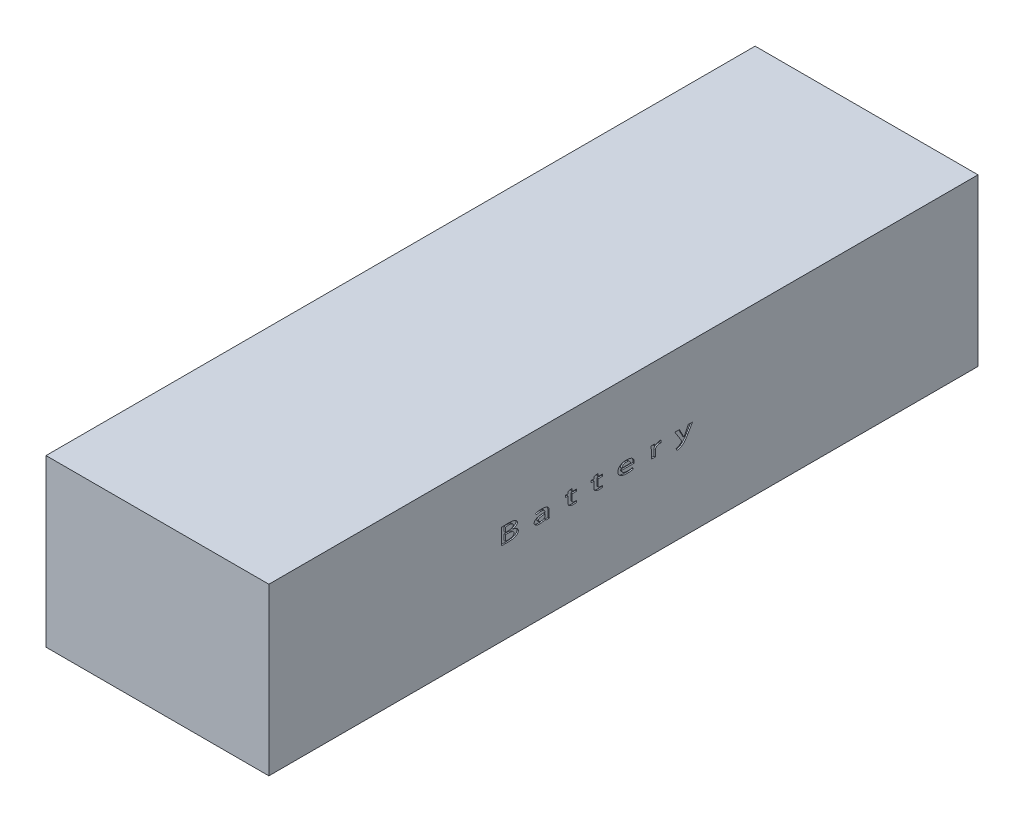
from build123d import *

# Parameters (mm, degrees)
SKETCH1_W           = 43.999912
SKETCH1_H           = 139.999974
BOSS_EXTRUDE1_DEPTH = 32.766
CUT_EXTRUDE1_DEPTH  = 0.254


with BuildPart() as part:
    # Sketch1 → Boss-Extrude1 (new body)
    with BuildSketch(Plane(origin=(0, 0, 0), x_dir=(1, 0, 0), z_dir=(0, 1, 0))):
        with Locations((-2.427323281, -29.833462089)):
            Rectangle(SKETCH1_W, SKETCH1_H)
    extrude(amount=BOSS_EXTRUDE1_DEPTH)

    # Sketch2 → Cut-Extrude1 (cut)
    # profile 1 of 7: a face of its own
    with BuildSketch(Plane(origin=(19.572632719, 0, 0), x_dir=(0, 0, -1), z_dir=(1, 0, 0))):
        with BuildLine():
            add(Edge.make_bspline(
                [(-51.644291749, 18.111815751), (-51.610507146, 18.120307394), (-51.544578306, 18.13687838), (-51.449522542, 18.165633579), (-51.360334848, 18.19672778), (-51.277262345, 18.230809107), (-51.199852593, 18.267227642), (-51.128459681, 18.306151153), (-51.062780328, 18.347347518), (-51.003702235, 18.391596204), (-50.950718277, 18.437680503), (-50.904535731, 18.485461918), (-50.865212213, 18.534652658), (-50.833330319, 18.585351353), (-50.807542728, 18.637101414), (-50.78985994, 18.690770773), (-50.777708305, 18.745758693), (-50.776006496, 18.783141249), (-50.775149692, 18.801962104)],
                knots=[0, 0, 0, 0, 1.40533938, 2.742444467, 4.005339358, 5.214808595, 6.363594937, 7.45521793, 8.493778442, 9.488835733, 10.430207034, 11.324115341, 12.1665113, 12.96612015, 13.736627496, 14.492742677, 15.241146812, 16, 16, 16, 16], degree=3))
            add(Edge.make_bspline(
                [(-50.775149692, 18.801962104), (-50.773682843, 18.823335988), (-50.770715604, 18.866572501), (-50.782452172, 18.932106535), (-50.806622471, 18.997213613), (-50.842948666, 19.0623868), (-50.893354834, 19.126484033), (-50.955081608, 19.191299937), (-51.03047204, 19.254909205), (-51.10079095, 19.308475992), (-51.165944689, 19.349378653), (-51.222050069, 19.379202484), (-51.284789928, 19.406670814), (-51.353622802, 19.43215787), (-51.428613329, 19.456353003), (-51.510160484, 19.477320745), (-51.597689402, 19.497915944), (-51.691698536, 19.516475165), (-51.791998322, 19.532308621), (-51.898608402, 19.546590729), (-52.011303771, 19.559988449), (-52.130505643, 19.570454061), (-52.255829064, 19.579428422), (-52.387330196, 19.586744752), (-52.525252611, 19.591192104), (-52.619250094, 19.593390293), (-52.667339549, 19.594514894)],
                knots=[0, 0, 0, 0, 0.685925799, 1.387536325, 2.117317602, 2.909010788, 3.772856223, 4.729195708, 5.778720239, 6.937293621, 7.564918212, 8.247182512, 8.975893934, 9.762644356, 10.603656649, 11.505160467, 12.4657627, 13.491243463, 14.581602467, 15.726198149, 16.945488129, 18.225886731, 19.56860428, 20.98046062, 22.455192665, 24, 24, 24, 24], degree=3))
            add(Edge.make_bspline(
                [(-52.667339549, 19.594514894), (-52.726802859, 19.594292528), (-52.84414423, 19.593853723), (-53.018156293, 19.590141046), (-53.187981987, 19.584249884), (-53.352408101, 19.57588769), (-53.508651089, 19.565793281), (-53.653932276, 19.554503707), (-53.787071588, 19.542181214), (-53.871550225, 19.532221193), (-53.911838983, 19.527471154)],
                knots=[0, 0, 0, 0, 1.144427208, 2.258344793, 3.349658298, 4.41477178, 5.426871411, 6.362906018, 7.219252515, 8, 8, 8, 8], degree=3))
            Line((-53.911838983, 19.527471154), (-53.911838399, 16.388208563))
            add(Edge.make_bspline(
                [(-53.911838399, 16.388208563), (-53.881119882, 16.385543687), (-53.815940003, 16.379889236), (-53.712332152, 16.373716328), (-53.597416486, 16.367433885), (-53.471065681, 16.363265526), (-53.33342362, 16.357736794), (-53.184131235, 16.355596012), (-53.023522376, 16.352021164), (-52.912570245, 16.351133509), (-52.855301464, 16.350675339)],
                knots=[0, 0, 0, 0, 0.699774169, 1.484811109, 2.355488637, 3.311718364, 4.353935581, 5.481794406, 6.700209146, 8, 8, 8, 8], degree=3))
            add(Edge.make_bspline(
                [(-52.855301464, 16.350675339), (-52.801825845, 16.350974392), (-52.696861732, 16.351561385), (-52.542776945, 16.35412016), (-52.395129349, 16.360534481), (-52.254009869, 16.367975406), (-52.119289185, 16.378142915), (-51.990952389, 16.390685588), (-51.869171753, 16.405471667), (-51.753795982, 16.422859475), (-51.644593815, 16.442593237), (-51.541160914, 16.464651827), (-51.443192811, 16.488978422), (-51.351482841, 16.516636403), (-51.265134215, 16.545681953), (-51.185283682, 16.578271132), (-51.110282615, 16.611906253), (-51.063709157, 16.637875088), (-51.040930235, 16.650576357)],
                knots=[0, 0, 0, 0, 1.382182602, 2.71300402, 3.982736333, 5.201693476, 6.365383053, 7.474336612, 8.534287225, 9.535711254, 10.489635997, 11.402018248, 12.268835929, 13.097727171, 13.877308873, 14.622384863, 15.326213083, 16, 16, 16, 16], degree=3))
            add(Edge.make_bspline(
                [(-51.040930235, 16.650576357), (-51.014857146, 16.664800643), (-50.961392717, 16.69396839), (-50.885777376, 16.749219888), (-50.811331991, 16.813425322), (-50.750314846, 16.872543688), (-50.705159029, 16.925839553), (-50.674928259, 16.969538077), (-50.648435188, 17.016030348), (-50.62713348, 17.06598718), (-50.609456587, 17.11858238), (-50.596528277, 17.174320962), (-50.587361166, 17.233154297), (-50.584868265, 17.273492249), (-50.583596148, 17.294076546)],
                knots=[0, 0, 0, 0, 1.286238673, 2.637509324, 4.048412503, 5.546762111, 6.3141741, 7.072318851, 7.846862039, 8.629332221, 9.422484273, 10.249026761, 11.106485285, 12, 12, 12, 12], degree=3))
            add(Edge.make_bspline(
                [(-50.583596148, 17.294076546), (-50.585690955, 17.321509085), (-50.589796999, 17.375279766), (-50.607840424, 17.453426275), (-50.63398903, 17.527638926), (-50.670209483, 17.597435555), (-50.715881065, 17.662651404), (-50.77004308, 17.724171262), (-50.834017036, 17.781040904), (-50.906495158, 17.833152811), (-50.984975624, 17.881130703), (-51.068052094, 17.924645706), (-51.154220579, 17.965217556), (-51.244967862, 18.000321623), (-51.33933143, 18.031287173), (-51.437391729, 18.05834035), (-51.539260127, 18.081255017), (-51.608941728, 18.092759706), (-51.6443239, 18.098601433)],
                knots=[0, 0, 0, 0, 0.913562479, 1.790679196, 2.657271798, 3.523635851, 4.395897479, 5.298288241, 6.242549711, 7.235072255, 8.262453639, 9.298111546, 10.351715563, 11.427167575, 12.530612634, 13.652370922, 14.807946209, 16, 16, 16, 16], degree=3))
            Line((-51.6443239, 18.098601433), (-51.644291749, 18.111815751))
        make_face()
        with BuildLine():
            Line((-53.112101181, 18.254238103), (-53.112101181, 19.199360883))
            add(Edge.make_bspline(
                [(-53.112101181, 19.199360883), (-53.099137156, 19.200832518), (-53.070843554, 19.204044316), (-53.024729712, 19.208105163), (-52.971644959, 19.212183776), (-52.911424493, 19.216739746), (-52.843341134, 19.219346829), (-52.766925797, 19.221962358), (-52.681707746, 19.222886807), (-52.622044926, 19.223210134), (-52.590718131, 19.223379902)],
                knots=[0, 0, 0, 0, 0.599590922, 1.30858956, 2.127236431, 3.046476336, 4.083695706, 5.258023581, 6.560287062, 8, 8, 8, 8], degree=3))
            add(Edge.make_bspline(
                [(-52.590718131, 19.223379902), (-52.527234433, 19.223144248), (-52.403610869, 19.222685354), (-52.223508796, 19.206031958), (-52.054653965, 19.175124117), (-51.922061697, 19.140316747), (-51.824829928, 19.104029341), (-51.761708357, 19.070628595), (-51.707500146, 19.031461172), (-51.662597162, 18.98650919), (-51.62586196, 18.936545608), (-51.599541142, 18.88011072), (-51.580855283, 18.818624675), (-51.5769091, 18.77516167), (-51.57488574, 18.752876508)],
                knots=[0, 0, 0, 0, 1.851259311, 3.605008578, 5.267298526, 6.854427038, 7.597018629, 8.289662199, 8.931136827, 9.54026623, 10.136381007, 10.729961357, 11.34880213, 12, 12, 12, 12], degree=3))
            add(Edge.make_bspline(
                [(-51.57488574, 18.752876508), (-51.576001183, 18.734808966), (-51.578217727, 18.69890616), (-51.593637658, 18.646977843), (-51.61556664, 18.597109805), (-51.647422924, 18.550685384), (-51.687815725, 18.507361692), (-51.735865448, 18.465729092), (-51.793116581, 18.427852045), (-51.858087318, 18.392627597), (-51.930143933, 18.360247655), (-52.009544449, 18.333309032), (-52.094948703, 18.308991696), (-52.186999995, 18.289647907), (-52.285688948, 18.2740191), (-52.390789006, 18.262943773), (-52.502423519, 18.255618082), (-52.578933695, 18.254311542), (-52.618253953, 18.253640083)],
                knots=[0, 0, 0, 0, 0.686723571, 1.364618527, 2.047638696, 2.75307796, 3.494649314, 4.29675263, 5.166438123, 6.100796313, 7.106810053, 8.168117075, 9.288194686, 10.483966669, 11.744669978, 13.088695348, 14.503816638, 16, 16, 16, 16], degree=3))
            Line((-52.618253953, 18.253640083), (-53.112101181, 18.254238103))
        make_face(mode=Mode.SUBTRACT)
        with BuildLine():
            Line((-53.112101181, 17.883103111), (-52.646058679, 17.883103111))
            add(Edge.make_bspline(
                [(-52.646058679, 17.883103111), (-52.606457516, 17.88273762), (-52.528504459, 17.882018168), (-52.413346102, 17.876952802), (-52.302189272, 17.866394243), (-52.194625308, 17.853110162), (-52.091010208, 17.834329086), (-51.990906676, 17.811690054), (-51.89458158, 17.784794101), (-51.802976462, 17.754190879), (-51.718088467, 17.719362012), (-51.643312826, 17.677321327), (-51.578856559, 17.629742695), (-51.524860673, 17.576442863), (-51.482437721, 17.516676196), (-51.449925715, 17.45189614), (-51.429447208, 17.380788691), (-51.424281007, 17.331313155), (-51.421642905, 17.306048643)],
                knots=[0, 0, 0, 0, 1.281443891, 2.522462947, 3.728387058, 4.893611254, 6.028385756, 7.134191537, 8.21353693, 9.262999663, 10.258314291, 11.177687313, 12.03124732, 12.843901211, 13.621480188, 14.392436769, 15.179103377, 16, 16, 16, 16], degree=3))
            add(Edge.make_bspline(
                [(-51.421642905, 17.306048643), (-51.423847263, 17.280780562), (-51.428158824, 17.231358071), (-51.44790737, 17.160467676), (-51.477253023, 17.095014324), (-51.517769055, 17.035317817), (-51.56843202, 16.981180346), (-51.629887752, 16.933130011), (-51.701153801, 16.890531178), (-51.782048554, 16.854148056), (-51.870057351, 16.822307428), (-51.963709482, 16.794904565), (-52.062212553, 16.771551614), (-52.165481425, 16.752435841), (-52.273799341, 16.738207659), (-52.386637644, 16.728244067), (-52.504445312, 16.72189616), (-52.584524189, 16.721839354), (-52.625437211, 16.721810332)],
                knots=[0, 0, 0, 0, 0.825140384, 1.613913382, 2.385120956, 3.153444474, 3.954004159, 4.791858536, 5.687383797, 6.653418539, 7.677895759, 8.735518243, 9.831720095, 10.975790606, 12.156656025, 13.390649828, 14.666859426, 16, 16, 16, 16], degree=3))
            add(Edge.make_bspline(
                [(-52.625437211, 16.721810332), (-52.674526416, 16.721780475), (-52.766929023, 16.721724273), (-52.897025926, 16.72507958), (-53.010284964, 16.728876126), (-53.079995375, 16.735104135), (-53.112102935, 16.737972662)],
                knots=[0, 0, 0, 0, 1.209222335, 2.27616837, 3.206029248, 4, 4, 4, 4], degree=3))
            Line((-53.112102935, 16.737972662), (-53.112101181, 17.883103111))
        make_face(mode=Mode.SUBTRACT)
    # profile 2 of 7: a face of its own
    with BuildSketch(Plane(origin=(19.572632719, 0, 0), x_dir=(0, 0, -1), z_dir=(1, 0, 0))):
        with BuildLine():
            add(Edge.make_bspline(
                [(-44.511105838, 17.774539344), (-44.51069283, 17.806379688), (-44.509877392, 17.869244931), (-44.522781498, 17.961811312), (-44.543730167, 18.051065126), (-44.576695123, 18.136142316), (-44.61954468, 18.217422357), (-44.672415941, 18.295256841), (-44.736751541, 18.36807325), (-44.796970596, 18.426026611), (-44.851088709, 18.469399081), (-44.896512459, 18.500230223), (-44.946150321, 18.528579529), (-44.999361444, 18.55566537), (-45.056813262, 18.580248558), (-45.118130092, 18.602892517), (-45.183577705, 18.623044064), (-45.252827268, 18.641750512), (-45.326093709, 18.658436668), (-45.403628064, 18.672661345), (-45.485078235, 18.685173322), (-45.570482314, 18.696059858), (-45.659951801, 18.704173778), (-45.7533349, 18.710953708), (-45.85075779, 18.714947097), (-45.917029751, 18.716281284), (-45.950753953, 18.716960219)],
                knots=[0, 0, 0, 0, 1.175097073, 2.320099431, 3.443145923, 4.556395639, 5.681038434, 6.832409001, 8.024035987, 9.265269995, 9.915865327, 10.584591153, 11.291530857, 12.026853553, 12.78975311, 13.599224161, 14.441089397, 15.319269759, 16.249370038, 17.216828846, 18.231462663, 19.294144735, 20.397584596, 21.550653699, 22.75358674, 24, 24, 24, 24], degree=3))
            add(Edge.make_bspline(
                [(-45.950753953, 18.716960219), (-46.013620718, 18.716000897), (-46.136840263, 18.714120615), (-46.317372014, 18.703967112), (-46.489753661, 18.687434545), (-46.652395951, 18.664021905), (-46.803910264, 18.636668711), (-46.942422108, 18.606457733), (-47.067273251, 18.572928681), (-47.144706346, 18.545985836), (-47.181485476, 18.533188537)],
                knots=[0, 0, 0, 0, 1.207104173, 2.365937362, 3.470692301, 4.531002334, 5.519938855, 6.426242244, 7.25249737, 8, 8, 8, 8], degree=3))
            Line((-47.181485476, 18.533188537), (-47.014544879, 18.210371009))
            add(Edge.make_bspline(
                [(-47.014544879, 18.210371009), (-46.982737379, 18.22280041), (-46.91723677, 18.248396052), (-46.813427513, 18.280011777), (-46.702932461, 18.309063212), (-46.585892468, 18.332386982), (-46.464943311, 18.352161971), (-46.341130186, 18.366669324), (-46.2154555, 18.375081197), (-46.130946311, 18.37632631), (-46.088433063, 18.376952677)],
                knots=[0, 0, 0, 0, 0.865696267, 1.782712677, 2.749790371, 3.761974007, 4.807613163, 5.857004061, 6.921943056, 8, 8, 8, 8], degree=3))
            add(Edge.make_bspline(
                [(-46.088433063, 18.376952677), (-46.044899644, 18.375291155), (-45.962052087, 18.372129147), (-45.844757658, 18.359389716), (-45.740756642, 18.342313195), (-45.649851706, 18.321020463), (-45.572381186, 18.293011838), (-45.508223431, 18.259810502), (-45.456613143, 18.221443707), (-45.419645945, 18.176364178), (-45.393177888, 18.12952454), (-45.369271521, 18.084911334), (-45.350677644, 18.040771083), (-45.336153476, 17.998015042), (-45.326471645, 17.956087322), (-45.32084204, 17.915220717), (-45.320123339, 17.875206788), (-45.323137517, 17.849163638), (-45.324613304, 17.836412519)],
                knots=[0, 0, 0, 0, 1.937439985, 3.687102254, 5.244083355, 6.624016093, 7.8343197, 8.898409296, 9.828702019, 10.673093576, 11.469221061, 12.219548966, 12.923503995, 13.597148598, 14.225845967, 14.834680682, 15.429442065, 16, 16, 16, 16], degree=3))
            add(Edge.make_bspline(
                [(-45.324613304, 17.836412519), (-45.404633802, 17.835840348), (-45.560337973, 17.834727015), (-45.787563352, 17.826044777), (-46.001568956, 17.809849191), (-46.202436547, 17.787818426), (-46.390162395, 17.760346576), (-46.564480222, 17.724848492), (-46.72591659, 17.683973091), (-46.851363216, 17.643784146), (-46.944386642, 17.607895322), (-47.008750936, 17.580256572), (-47.068531594, 17.549922423), (-47.123971316, 17.518224004), (-47.175950867, 17.485713719), (-47.222400555, 17.449969862), (-47.265357744, 17.413787044), (-47.303130961, 17.374905855), (-47.337536203, 17.33514729), (-47.366922349, 17.292863035), (-47.392240362, 17.249039934), (-47.41322871, 17.203338762), (-47.430130573, 17.156122757), (-47.442073073, 17.106952069), (-47.449974644, 17.056270435), (-47.451756346, 17.021738985), (-47.452653463, 17.00435181)],
                knots=[0, 0, 0, 0, 2.319145786, 4.512602176, 6.588780181, 8.537850986, 10.368209225, 12.085289648, 13.691265688, 15.192708731, 15.89936613, 16.580504135, 17.2218911, 17.840910598, 18.431253869, 18.996831738, 19.538148586, 20.057488983, 20.566191964, 21.060321819, 21.547362121, 22.031233527, 22.515933599, 22.998420732, 23.495687737, 24, 24, 24, 24], degree=3))
            add(Edge.make_bspline(
                [(-47.452653463, 17.00435181), (-47.451540152, 16.981917704), (-47.449340308, 16.937589067), (-47.434105354, 16.872849241), (-47.411505538, 16.810352966), (-47.378688691, 16.750851002), (-47.336749621, 16.69419384), (-47.286180903, 16.640113889), (-47.226204316, 16.589253538), (-47.158126177, 16.54084269), (-47.081584574, 16.496500043), (-46.99657576, 16.458370281), (-46.904218558, 16.42566949), (-46.804283118, 16.397872456), (-46.696534057, 16.376909076), (-46.581075635, 16.36057602), (-46.45793478, 16.350624916), (-46.373186577, 16.348285126), (-46.329670808, 16.34708371)],
                knots=[0, 0, 0, 0, 0.750511685, 1.48297235, 2.21628528, 2.969526539, 3.748393557, 4.5707007, 5.442262283, 6.37636123, 7.363928854, 8.398211377, 9.490482838, 10.641058478, 11.867172727, 13.162248732, 14.542896199, 16, 16, 16, 16], degree=3))
            add(Edge.make_bspline(
                [(-46.329670808, 16.34708371), (-46.271754913, 16.348201516), (-46.15926328, 16.350372661), (-45.99638701, 16.367986662), (-45.844047176, 16.392709015), (-45.703599296, 16.429258969), (-45.57569307, 16.474368118), (-45.460096179, 16.524094197), (-45.357710352, 16.580541018), (-45.297827441, 16.625364314), (-45.268943056, 16.646984729)],
                knots=[0, 0, 0, 0, 1.238809554, 2.406173785, 3.501775666, 4.538290854, 5.506387597, 6.401092189, 7.228770462, 8, 8, 8, 8], degree=3))
            Line((-45.268943056, 16.646984729), (-45.247549948, 16.647102228))
            Line((-45.247549948, 16.647102228), (-45.191440099, 16.385393835))
            Line((-45.191440099, 16.385393835), (-44.45535141, 16.385393835))
            add(Edge.make_bspline(
                [(-44.45535141, 16.385393835), (-44.461042085, 16.404679362), (-44.472738314, 16.444317527), (-44.485344157, 16.506428525), (-44.495902487, 16.571890986), (-44.503853791, 16.664217328), (-44.510648086, 16.783562632), (-44.510954185, 16.880029328), (-44.511109345, 16.928927602)],
                knots=[0, 0, 0, 0, 0.659613556, 1.355725, 2.078136816, 2.834647581, 4.395505649, 6, 6, 6, 6], degree=3))
            Line((-44.511109345, 16.928927602), (-44.511105838, 17.774539344))
        make_face()
        with BuildLine():
            add(Edge.make_bspline(
                [(-45.303659797, 17.157166152), (-45.304903965, 17.140261532), (-45.30736216, 17.106861807), (-45.320734911, 17.058358323), (-45.339650939, 17.01206902), (-45.365973971, 16.968528442), (-45.398596999, 16.927317271), (-45.438764937, 16.889169409), (-45.484758377, 16.852457421), (-45.537642642, 16.819358517), (-45.595071126, 16.789122611), (-45.65661351, 16.762801646), (-45.721309208, 16.739853439), (-45.789664763, 16.721663767), (-45.861134476, 16.706436835), (-45.936135273, 16.695818624), (-46.014693458, 16.689268834), (-46.068267639, 16.687827187), (-46.095616321, 16.687091252)],
                knots=[0, 0, 0, 0, 0.804507734, 1.589526174, 2.380944637, 3.176903039, 4.001052039, 4.873621094, 5.80598128, 6.795979721, 7.836119167, 8.890451785, 9.97709827, 11.098383502, 12.252488745, 13.451123295, 14.698843085, 16, 16, 16, 16], degree=3))
            add(Edge.make_bspline(
                [(-46.095616321, 16.687091252), (-46.132405419, 16.687734008), (-46.203609887, 16.688978048), (-46.306080151, 16.706394848), (-46.400284695, 16.733474348), (-46.471955076, 16.765984266), (-46.522972806, 16.797865075), (-46.556183045, 16.824985298), (-46.584850258, 16.855170408), (-46.608232582, 16.888983581), (-46.626981078, 16.925832266), (-46.640716483, 16.965721024), (-46.649940899, 17.008748861), (-46.651904498, 17.038624675), (-46.652917414, 17.054036011)],
                knots=[0, 0, 0, 0, 1.774995276, 3.435463203, 5.002930675, 6.499276085, 7.218489681, 7.903370446, 8.564723899, 9.222415656, 9.881870381, 10.555469583, 11.254843944, 12, 12, 12, 12], degree=3))
            add(Edge.make_bspline(
                [(-46.652917414, 17.054036011), (-46.649647118, 17.077990528), (-46.643225137, 17.125030751), (-46.617859506, 17.191345239), (-46.580598402, 17.25141634), (-46.53052775, 17.304251965), (-46.46884329, 17.351252384), (-46.394339188, 17.389902342), (-46.308595773, 17.423854109), (-46.176522525, 17.458451259), (-45.998864117, 17.490959028), (-45.776053135, 17.519451477), (-45.543116788, 17.534411116), (-45.384492664, 17.534216336), (-45.303662135, 17.534117081)],
                knots=[0, 0, 0, 0, 0.559527784, 1.098761892, 1.633263596, 2.190218119, 2.778293053, 3.424639982, 4.131434944, 4.914419041, 6.588084024, 8.319680607, 10.124609599, 12, 12, 12, 12], degree=3))
            Line((-45.303662135, 17.534117081), (-45.303659797, 17.157166152))
        make_face(mode=Mode.SUBTRACT)
    # profile 3 of 7: a face of its own
    with BuildSketch(Plane(origin=(19.572632719, 0, 0), x_dir=(0, 0, -1), z_dir=(1, 0, 0))):
        with BuildLine():
            Line((-40.763603104, 18.675655901), (-41.307208774, 18.675655901))
            Line((-41.307208774, 18.675655901), (-41.307208774, 18.304520324))
            Line((-41.307208774, 18.304520324), (-40.763603104, 18.304520324))
            Line((-40.763603104, 18.304520324), (-40.763603104, 17.117494552))
            add(Edge.make_bspline(
                [(-40.763603104, 17.117494552), (-40.762952129, 17.081724719), (-40.761707083, 17.013311938), (-40.748116235, 16.915486632), (-40.727378824, 16.826993642), (-40.696414293, 16.747868674), (-40.656558305, 16.676899225), (-40.60622703, 16.614760907), (-40.547736153, 16.558609149), (-40.501978971, 16.529515128), (-40.478667792, 16.514693062)],
                knots=[0, 0, 0, 0, 1.223601265, 2.340239155, 3.373938585, 4.327739138, 5.239299584, 6.148117949, 7.056551249, 8, 8, 8, 8], degree=3))
            add(Edge.make_bspline(
                [(-40.478667792, 16.514693062), (-40.456395798, 16.501576186), (-40.410366465, 16.474467654), (-40.333024718, 16.443083865), (-40.248509427, 16.413999535), (-40.1552487, 16.391249759), (-40.055188927, 16.372436908), (-39.948498426, 16.360818642), (-39.836326166, 16.351546314), (-39.759565602, 16.350970415), (-39.720235476, 16.350675339)],
                knots=[0, 0, 0, 0, 0.789032034, 1.63068555, 2.544851542, 3.519626375, 4.561518372, 5.654629768, 6.798293014, 8, 8, 8, 8], degree=3))
            add(Edge.make_bspline(
                [(-39.720235476, 16.350675339), (-39.686911846, 16.350989504), (-39.622252093, 16.351599094), (-39.528249703, 16.353880038), (-39.440412483, 16.357855295), (-39.35884812, 16.364262517), (-39.283520423, 16.370320674), (-39.214435885, 16.37873635), (-39.151538966, 16.388779199), (-39.111826928, 16.397026806), (-39.092897618, 16.400958145)],
                knots=[0, 0, 0, 0, 1.268637777, 2.461610698, 3.579501031, 4.615358006, 5.576105585, 6.456105163, 7.264080517, 8, 8, 8, 8], degree=3))
            Line((-39.092897618, 16.400958145), (-39.120580168, 16.750966011))
            add(Edge.make_bspline(
                [(-39.120580168, 16.750966011), (-39.145446552, 16.746858675), (-39.196686893, 16.738394988), (-39.262781798, 16.730410687), (-39.320116481, 16.725622444), (-39.368432906, 16.723324275), (-39.421128061, 16.722288276), (-39.457647159, 16.721973648), (-39.476603312, 16.721810332)],
                knots=[0, 0, 0, 0, 1.268017957, 2.612912017, 3.348274057, 4.162472496, 5.046185306, 6, 6, 6, 6], degree=3))
            add(Edge.make_bspline(
                [(-39.476603312, 16.721810332), (-39.497165387, 16.72192843), (-39.536756022, 16.722155818), (-39.594167624, 16.727030727), (-39.64717455, 16.735281292), (-39.696010538, 16.746658428), (-39.740665296, 16.760807141), (-39.780814798, 16.778715381), (-39.816789979, 16.799973638), (-39.84881908, 16.824461317), (-39.87638376, 16.853022645), (-39.900594919, 16.884161484), (-39.920679823, 16.919015399), (-39.936567928, 16.9573311), (-39.94917605, 16.998846379), (-39.958049946, 17.043546566), (-39.963672734, 17.091603034), (-39.963801252, 17.124854318), (-39.963867641, 17.14203092)],
                knots=[0, 0, 0, 0, 1.330018719, 2.560844892, 3.723996818, 4.798120937, 5.802477984, 6.750225736, 7.635880845, 8.500971941, 9.350018932, 10.197002144, 11.047324202, 11.944107126, 12.875266125, 13.850063143, 14.889408025, 16, 16, 16, 16], degree=3))
            Line((-39.963867641, 17.14203092), (-39.963865887, 18.304520324))
            Line((-39.963865887, 18.304520324), (-39.050887134, 18.304520324))
            Line((-39.050887134, 18.304520324), (-39.050887134, 18.675655901))
            Line((-39.050887134, 18.675655901), (-39.963865887, 18.675655901))
            Line((-39.963865887, 18.675655901), (-39.963865887, 19.238372498))
            Line((-39.963865887, 19.238372498), (-40.763603104, 19.089418104))
            Line((-40.763603104, 19.089418104), (-40.763603104, 18.675655901))
        make_face()
    # profile 4 of 7: a face of its own
    with BuildSketch(Plane(origin=(19.572632719, 0, 0), x_dir=(0, 0, -1), z_dir=(1, 0, 0))):
        with BuildLine():
            Line((-35.645292396, 18.675655901), (-36.188898065, 18.675655901))
            Line((-36.188898065, 18.675655901), (-36.188898065, 18.304520324))
            Line((-36.188898065, 18.304520324), (-35.645292396, 18.304520324))
            Line((-35.645292396, 18.304520324), (-35.645292396, 17.117494552))
            add(Edge.make_bspline(
                [(-35.645292396, 17.117494552), (-35.64464142, 17.081724719), (-35.643396374, 17.013311938), (-35.629805526, 16.915486632), (-35.609068115, 16.826993642), (-35.578103585, 16.747868674), (-35.538247596, 16.676899225), (-35.487916321, 16.614760907), (-35.429425444, 16.558609149), (-35.383668263, 16.529515128), (-35.360357083, 16.514693062)],
                knots=[0, 0, 0, 0, 1.223601265, 2.340239155, 3.373938585, 4.327739138, 5.239299584, 6.148117949, 7.056551249, 8, 8, 8, 8], degree=3))
            add(Edge.make_bspline(
                [(-35.360357083, 16.514693062), (-35.338085089, 16.501576186), (-35.292055756, 16.474467654), (-35.214714009, 16.443083865), (-35.130198718, 16.413999535), (-35.036937991, 16.391249759), (-34.936878218, 16.372436908), (-34.830187717, 16.360818642), (-34.718015457, 16.351546314), (-34.641254893, 16.350970415), (-34.601924767, 16.350675339)],
                knots=[0, 0, 0, 0, 0.789032034, 1.63068555, 2.544851542, 3.519626375, 4.561518372, 5.654629768, 6.798293014, 8, 8, 8, 8], degree=3))
            add(Edge.make_bspline(
                [(-34.601924767, 16.350675339), (-34.568601137, 16.350989504), (-34.503941384, 16.351599094), (-34.409938994, 16.353880038), (-34.322101774, 16.357855295), (-34.240537411, 16.364262517), (-34.165209714, 16.370320674), (-34.096125176, 16.37873635), (-34.033228258, 16.388779199), (-33.993516219, 16.397026806), (-33.974586909, 16.400958145)],
                knots=[0, 0, 0, 0, 1.268637777, 2.461610698, 3.579501031, 4.615358006, 5.576105585, 6.456105163, 7.264080517, 8, 8, 8, 8], degree=3))
            Line((-33.974586909, 16.400958145), (-34.00226946, 16.750966011))
            add(Edge.make_bspline(
                [(-34.00226946, 16.750966011), (-34.027135843, 16.746858675), (-34.078376185, 16.738394988), (-34.144471089, 16.730410687), (-34.201805772, 16.725622444), (-34.250122197, 16.723324275), (-34.302817352, 16.722288276), (-34.33933645, 16.721973648), (-34.358292603, 16.721810332)],
                knots=[0, 0, 0, 0, 1.268017957, 2.612912017, 3.348274057, 4.162472496, 5.046185306, 6, 6, 6, 6], degree=3))
            add(Edge.make_bspline(
                [(-34.358292603, 16.721810332), (-34.378854678, 16.72192843), (-34.418445313, 16.722155818), (-34.475856915, 16.727030727), (-34.528863841, 16.735281292), (-34.577699829, 16.746658428), (-34.622354587, 16.760807141), (-34.662504089, 16.778715381), (-34.69847927, 16.799973638), (-34.730508371, 16.824461317), (-34.758073051, 16.853022645), (-34.78228421, 16.884161484), (-34.802369114, 16.919015399), (-34.818257219, 16.9573311), (-34.830865341, 16.998846379), (-34.839739237, 17.043546566), (-34.845362025, 17.091603034), (-34.845490543, 17.124854318), (-34.845556932, 17.14203092)],
                knots=[0, 0, 0, 0, 1.330018719, 2.560844892, 3.723996818, 4.798120937, 5.802477984, 6.750225736, 7.635880845, 8.500971941, 9.350018932, 10.197002144, 11.047324202, 11.944107126, 12.875266125, 13.850063143, 14.889408025, 16, 16, 16, 16], degree=3))
            Line((-34.845556932, 17.14203092), (-34.845555178, 18.304520324))
            Line((-34.845555178, 18.304520324), (-33.932576425, 18.304520324))
            Line((-33.932576425, 18.304520324), (-33.932576425, 18.675655901))
            Line((-33.932576425, 18.675655901), (-34.845555178, 18.675655901))
            Line((-34.845555178, 18.675655901), (-34.845555178, 19.238372498))
            Line((-34.845555178, 19.238372498), (-35.645292396, 19.089418104))
            Line((-35.645292396, 19.089418104), (-35.645292396, 18.675655901))
        make_face()
    # profile 5 of 7: a face of its own
    with BuildSketch(Plane(origin=(19.572632719, 0, 0), x_dir=(0, 0, -1), z_dir=(1, 0, 0))):
        with BuildLine():
            add(Edge.make_bspline(
                [(-28.02261434, 16.827929405), (-28.05402648, 16.820272606), (-28.118860244, 16.80446919), (-28.219857726, 16.784399882), (-28.327259065, 16.766475231), (-28.44179592, 16.750670957), (-28.56538915, 16.738266615), (-28.69930773, 16.728505459), (-28.844467485, 16.72354704), (-28.94486683, 16.722403523), (-28.996948335, 16.721810332)],
                knots=[0, 0, 0, 0, 0.789618374, 1.62974986, 2.514281086, 3.448883772, 4.453188384, 5.547643297, 6.727855972, 8, 8, 8, 8], degree=3))
            add(Edge.make_bspline(
                [(-28.996948335, 16.721810332), (-29.03626544, 16.722063516), (-29.113362468, 16.722559987), (-29.226849051, 16.729164681), (-29.335966819, 16.74099112), (-29.440635541, 16.758420009), (-29.541053717, 16.780405265), (-29.637051135, 16.807934783), (-29.728822718, 16.840956163), (-29.815894127, 16.878621982), (-29.896345923, 16.922339109), (-29.967599048, 16.973529467), (-30.029445979, 17.031147229), (-30.080732999, 17.096230168), (-30.123220854, 17.167227313), (-30.155005701, 17.24535335), (-30.176677751, 17.330017189), (-30.183482084, 17.388940024), (-30.18697473, 17.419184955)],
                knots=[0, 0, 0, 0, 1.23368156, 2.419129846, 3.565604378, 4.676331213, 5.747378914, 6.789820605, 7.807867862, 8.806041093, 9.764539013, 10.675146914, 11.55222043, 12.407888197, 13.266985692, 14.140251183, 15.045396013, 16, 16, 16, 16], degree=3))
            Line((-30.18697473, 17.419184955), (-27.720903478, 17.419782975))
            add(Edge.make_bspline(
                [(-27.720903478, 17.419782975), (-27.717876442, 17.434518811), (-27.71156641, 17.465236521), (-27.705265885, 17.513625996), (-27.700824202, 17.565760586), (-27.700524765, 17.601749054), (-27.70037028, 17.620316176)],
                knots=[0, 0, 0, 0, 0.89349896, 1.862550644, 2.897250025, 4, 4, 4, 4], degree=3))
            add(Edge.make_bspline(
                [(-27.70037028, 17.620316176), (-27.700677668, 17.656295154), (-27.701287017, 17.727618017), (-27.717785763, 17.832536067), (-27.743732316, 17.934176694), (-27.782620646, 18.031350304), (-27.832122635, 18.125234125), (-27.893514895, 18.214885582), (-27.966060054, 18.301117292), (-28.049782067, 18.383302136), (-28.146399237, 18.459366324), (-28.257781893, 18.525373177), (-28.383324086, 18.581336354), (-28.522714076, 18.628684879), (-28.67671026, 18.66528905), (-28.844616651, 18.692138449), (-29.026469771, 18.711241395), (-29.152534805, 18.715008795), (-29.217833516, 18.716960219)],
                knots=[0, 0, 0, 0, 0.819715263, 1.624961088, 2.415394053, 3.208182229, 4.006296127, 4.831903807, 5.68156256, 6.573100061, 7.503611961, 8.479321354, 9.518208176, 10.633683883, 11.832538509, 13.124026794, 14.510313805, 16, 16, 16, 16], degree=3))
            add(Edge.make_bspline(
                [(-29.217833516, 18.716960219), (-29.28532035, 18.714958195), (-29.416547042, 18.711065304), (-29.607260749, 18.692288995), (-29.785892162, 18.6639766), (-29.952545921, 18.625383935), (-30.106946531, 18.575720662), (-30.249475336, 18.515856142), (-30.380338558, 18.446092648), (-30.497601549, 18.364796574), (-30.602361641, 18.276473542), (-30.693992407, 18.182162482), (-30.772271507, 18.08244841), (-30.835192446, 17.976092332), (-30.885901239, 17.864755719), (-30.920609326, 17.747018911), (-30.943945292, 17.624221142), (-30.946900934, 17.540212391), (-30.948400069, 17.497602187)],
                knots=[0, 0, 0, 0, 1.371641655, 2.667127607, 3.890982695, 5.044624266, 6.139660945, 7.182648261, 8.18224526, 9.147222782, 10.076512876, 10.962550312, 11.814959528, 12.645922279, 13.468063847, 14.294115457, 15.134755759, 16, 16, 16, 16], degree=3))
            add(Edge.make_bspline(
                [(-30.948400069, 17.497602187), (-30.946673316, 17.455195495), (-30.94327604, 17.371763036), (-30.919944289, 17.25024634), (-30.882869204, 17.135149562), (-30.830114379, 17.027172014), (-30.762978358, 16.925896594), (-30.681563776, 16.83112099), (-30.584463438, 16.74435306), (-30.474353763, 16.663392886), (-30.349968223, 16.590964196), (-30.212136179, 16.528499743), (-30.061683373, 16.474349173), (-29.89800592, 16.430615468), (-29.721403468, 16.39596011), (-29.531828194, 16.371465989), (-29.329258441, 16.354895217), (-29.189733319, 16.352109969), (-29.11786651, 16.350675339)],
                knots=[0, 0, 0, 0, 0.844067252, 1.660648403, 2.454651232, 3.245327484, 4.045281321, 4.867889978, 5.725728799, 6.632371001, 7.584931193, 8.585776224, 9.641374383, 10.765085916, 11.955599738, 13.222043382, 14.569125917, 16, 16, 16, 16], degree=3))
            add(Edge.make_bspline(
                [(-29.11786651, 16.350675339), (-29.052808301, 16.351284144), (-28.926236562, 16.352468584), (-28.742220663, 16.360617433), (-28.569451305, 16.37187275), (-28.408811038, 16.389518867), (-28.26070168, 16.410249911), (-28.125833373, 16.433795902), (-28.004163676, 16.458030541), (-27.928353077, 16.478215671), (-27.89252243, 16.487755845)],
                knots=[0, 0, 0, 0, 1.262820278, 2.456836128, 3.575011808, 4.622946808, 5.593025699, 6.477496239, 7.280413342, 8, 8, 8, 8], degree=3))
            Line((-27.89252243, 16.487755845), (-28.02261434, 16.827929405))
        make_face()
        with BuildLine():
            add(Edge.make_bspline(
                [(-30.179844668, 17.759791101), (-30.177033088, 17.777633989), (-30.171368955, 17.813579791), (-30.155468054, 17.866367393), (-30.133553809, 17.918393843), (-30.105860997, 17.96974341), (-30.072803172, 18.020913664), (-30.03366319, 18.071295096), (-29.98849544, 18.12075687), (-29.938571655, 18.170076666), (-29.88193329, 18.216740547), (-29.81652621, 18.256504768), (-29.744311347, 18.291619585), (-29.664236675, 18.319855495), (-29.57723499, 18.343369264), (-29.48286919, 18.360210629), (-29.381347885, 18.372567234), (-29.311054038, 18.375457798), (-29.274700974, 18.376952677)],
                knots=[0, 0, 0, 0, 0.724992318, 1.460550003, 2.207894, 2.989695703, 3.801259422, 4.652661079, 5.549385024, 6.490375657, 7.470631364, 8.489427497, 9.557820595, 10.691263568, 11.894900327, 13.174710651, 14.538877426, 16, 16, 16, 16], degree=3))
            add(Edge.make_bspline(
                [(-29.274700974, 18.376952677), (-29.237162476, 18.375379389), (-29.164921924, 18.372351693), (-29.061067151, 18.361213173), (-28.966086891, 18.343781074), (-28.879713461, 18.321669812), (-28.80247638, 18.292873351), (-28.734235303, 18.258569505), (-28.674040731, 18.219538548), (-28.624464977, 18.173070261), (-28.582039044, 18.124417444), (-28.545380555, 18.0747434), (-28.514687796, 18.024285445), (-28.489611608, 17.973186099), (-28.471747859, 17.920809333), (-28.459681228, 17.867854306), (-28.453325437, 17.814016779), (-28.454181112, 17.777962172), (-28.454612362, 17.759791101)],
                knots=[0, 0, 0, 0, 1.558448233, 2.999138603, 4.328897634, 5.561723642, 6.693348372, 7.741019948, 8.725952821, 9.657540238, 10.549175936, 11.40184147, 12.215312578, 12.996512807, 13.758305992, 14.505339185, 15.246709641, 16, 16, 16, 16], degree=3))
            Line((-28.454612362, 17.759791101), (-30.179844668, 17.759791101))
        make_face(mode=Mode.SUBTRACT)
    # profile 6 of 7: a face of its own
    with BuildSketch(Plane(origin=(19.572632719, 0, 0), x_dir=(0, 0, -1), z_dir=(1, 0, 0))):
        with BuildLine():
            add(Edge.make_bspline(
                [(-22.414176054, 18.717558824), (-22.446990374, 18.716723127), (-22.514519445, 18.715003336), (-22.582058676, 18.7162958), (-22.616778651, 18.716960219)],
                knots=[0, 0, 0, 0, 0.971857566, 2, 2, 2, 2], degree=3))
            add(Edge.make_bspline(
                [(-22.616778651, 18.716960219), (-22.669140908, 18.715251424), (-22.772393826, 18.711881859), (-22.924007683, 18.688128923), (-23.068943607, 18.64896097), (-23.184153071, 18.604573166), (-23.271304586, 18.562336626), (-23.33274419, 18.527715372), (-23.389442357, 18.489231936), (-23.442490583, 18.448335585), (-23.491720088, 18.404927655), (-23.536257132, 18.357605086), (-23.577078334, 18.307831878), (-23.60058895, 18.272015967), (-23.612258478, 18.254238688)],
                knots=[0, 0, 0, 0, 1.648604331, 3.25087612, 4.819290953, 6.368902286, 7.130467158, 7.867745428, 8.587491782, 9.286280274, 9.976112666, 10.651689771, 11.330764278, 12, 12, 12, 12], degree=3))
            Line((-23.612258478, 18.254238688), (-23.639628865, 18.254426336))
            Line((-23.639628865, 18.254426336), (-23.667206777, 18.679248115))
            Line((-23.667206777, 18.679248115), (-24.363848342, 18.679248115))
            add(Edge.make_bspline(
                [(-24.363848342, 18.679248115), (-24.359471127, 18.62599096), (-24.350445281, 18.51617438), (-24.34188689, 18.346300548), (-24.336160207, 18.166284043), (-24.336035744, 18.042936116), (-24.335971713, 17.979479072)],
                knots=[0, 0, 0, 0, 0.915268496, 1.887289293, 2.913103951, 4, 4, 4, 4], degree=3))
            Line((-24.335971713, 17.979479072), (-24.335971129, 16.385393835))
            Line((-24.335971129, 16.385393835), (-23.536233911, 16.385393835))
            Line((-23.536233911, 16.385393835), (-23.536233911, 17.601090088))
            add(Edge.make_bspline(
                [(-23.536233911, 17.601090088), (-23.53519224, 17.62551137), (-23.533148632, 17.673422374), (-23.520723928, 17.743021962), (-23.502352219, 17.809282548), (-23.475864982, 17.871568493), (-23.442189335, 17.930146197), (-23.400893276, 17.984190091), (-23.35326326, 18.035099215), (-23.29811522, 18.081507187), (-23.236628953, 18.123419899), (-23.16888901, 18.159189731), (-23.096305632, 18.1904507), (-23.018059701, 18.216348882), (-22.934038233, 18.235798339), (-22.844591017, 18.249807531), (-22.749891767, 18.25991445), (-22.684847874, 18.261306699), (-22.651497731, 18.262020551)],
                knots=[0, 0, 0, 0, 0.946860679, 1.857602997, 2.734387595, 3.608094426, 4.474680913, 5.347428003, 6.239609914, 7.172817425, 8.136354605, 9.119419422, 10.138394898, 11.197808717, 12.310683571, 13.478366255, 14.707075485, 16, 16, 16, 16], degree=3))
            add(Edge.make_bspline(
                [(-22.651497731, 18.262020551), (-22.609356217, 18.26197517), (-22.530134714, 18.26188986), (-22.451333493, 18.253823807), (-22.41445022, 18.250048454)],
                knots=[0, 0, 0, 0, 1.063890816, 2, 2, 2, 2], degree=3))
            Line((-22.41445022, 18.250048454), (-22.414176054, 18.717558824))
        make_face()
    # profile 7 of 7: a face of its own
    with BuildSketch(Plane(origin=(19.572632719, 0, 0), x_dir=(0, 0, -1), z_dir=(1, 0, 0))):
        with BuildLine():
            Line((-17.045423466, 18.679248115), (-17.665119175, 17.396585284))
            add(Edge.make_bspline(
                [(-17.665119175, 17.396585284), (-17.683073888, 17.357461802), (-17.718985668, 17.279209707), (-17.77090518, 17.16250397), (-17.820670541, 17.049886134), (-17.852114519, 16.976248054), (-17.867208516, 16.940899698)],
                knots=[0, 0, 0, 0, 1.03621167, 2.072559208, 3.074774058, 4, 4, 4, 4], degree=3))
            Line((-17.867208516, 16.940899698), (-17.887931116, 16.941446861))
            add(Edge.make_bspline(
                [(-17.887931116, 16.941446861), (-17.903065659, 16.976828391), (-17.934709964, 17.050806441), (-17.985636904, 17.163895343), (-18.039310945, 17.280625152), (-18.077914305, 17.358025131), (-18.097072769, 17.396437971)],
                knots=[0, 0, 0, 0, 0.922007103, 1.927793554, 2.971584539, 4, 4, 4, 4], degree=3))
            Line((-18.097072769, 17.396437971), (-18.793104623, 18.679248115))
            Line((-18.793104623, 18.679248115), (-19.677389511, 18.679248115))
            Line((-19.677389511, 18.679248115), (-18.361406489, 16.577336122))
            add(Edge.make_bspline(
                [(-18.361406489, 16.577336122), (-18.354465032, 16.567164606), (-18.341829365, 16.548649202), (-18.327943591, 16.521746999), (-18.319223467, 16.498464444), (-18.319590329, 16.484016184), (-18.319753764, 16.477579563)],
                knots=[0, 0, 0, 0, 1.33920876, 2.437787332, 3.304042675, 4, 4, 4, 4], degree=3))
            add(Edge.make_bspline(
                [(-18.319753764, 16.477579563), (-18.320187901, 16.470908153), (-18.321218811, 16.45506606), (-18.333813512, 16.429881381), (-18.353487071, 16.399834115), (-18.381263153, 16.36407518), (-18.417393997, 16.322705874), (-18.462452707, 16.276476693), (-18.515305006, 16.224363719), (-18.575531156, 16.166631526), (-18.646420476, 16.108018584), (-18.728923917, 16.051716336), (-18.822600224, 15.998672255), (-18.927490434, 15.948634108), (-19.042985243, 15.900021562), (-19.170174823, 15.85481452), (-19.308486689, 15.81244438), (-19.404925913, 15.78723312), (-19.454708516, 15.774218891)],
                knots=[0, 0, 0, 0, 0.230790716, 0.548041309, 0.960191158, 1.485099295, 2.119942253, 2.871214072, 3.730360792, 4.702854268, 5.773155695, 6.926691478, 8.173641888, 9.515102186, 10.968296941, 12.531901102, 14.209743078, 16, 16, 16, 16], degree=3))
            Line((-19.454708516, 15.774218891), (-19.245691377, 15.369150488))
            add(Edge.make_bspline(
                [(-19.245691377, 15.369150488), (-19.219324565, 15.372510156), (-19.16243125, 15.379759521), (-19.072175596, 15.399748164), (-18.969685515, 15.423023184), (-18.857266931, 15.454209417), (-18.736646764, 15.491641563), (-18.611945185, 15.539968402), (-18.483443457, 15.596821587), (-18.398163412, 15.640500743), (-18.354472844, 15.662878394)],
                knots=[0, 0, 0, 0, 0.67599277, 1.458631772, 2.350260837, 3.350394947, 4.426223735, 5.562428189, 6.751186231, 8, 8, 8, 8], degree=3))
            add(Edge.make_bspline(
                [(-18.354472844, 15.662878394), (-18.326522993, 15.67929943), (-18.270219311, 15.712378848), (-18.189218485, 15.768525284), (-18.109259878, 15.828523063), (-18.030876966, 15.892927695), (-17.954716637, 15.962827724), (-17.880122679, 16.037175702), (-17.805984873, 16.115289301), (-17.734871332, 16.200012103), (-17.66323939, 16.28980078), (-17.590272909, 16.385662137), (-17.515441877, 16.487907737), (-17.439480919, 16.59693468), (-17.362159605, 16.712759416), (-17.283472759, 16.835177927), (-17.202923769, 16.964213434), (-17.149740726, 17.052953229), (-17.122544111, 17.098332768)],
                knots=[0, 0, 0, 0, 0.813336347, 1.6384284, 2.471747079, 3.321988267, 4.18336526, 5.065114985, 5.96500929, 6.885173066, 7.84012467, 8.847750262, 9.908507874, 11.019916659, 12.182466479, 13.403506104, 14.672211307, 16, 16, 16, 16], degree=3))
            Line((-17.122544111, 17.098332768), (-16.195899748, 18.679248115))
            Line((-16.195899748, 18.679248115), (-17.045423466, 18.679248115))
        make_face()
    extrude(amount=-CUT_EXTRUDE1_DEPTH, mode=Mode.SUBTRACT)


solid = part.part
